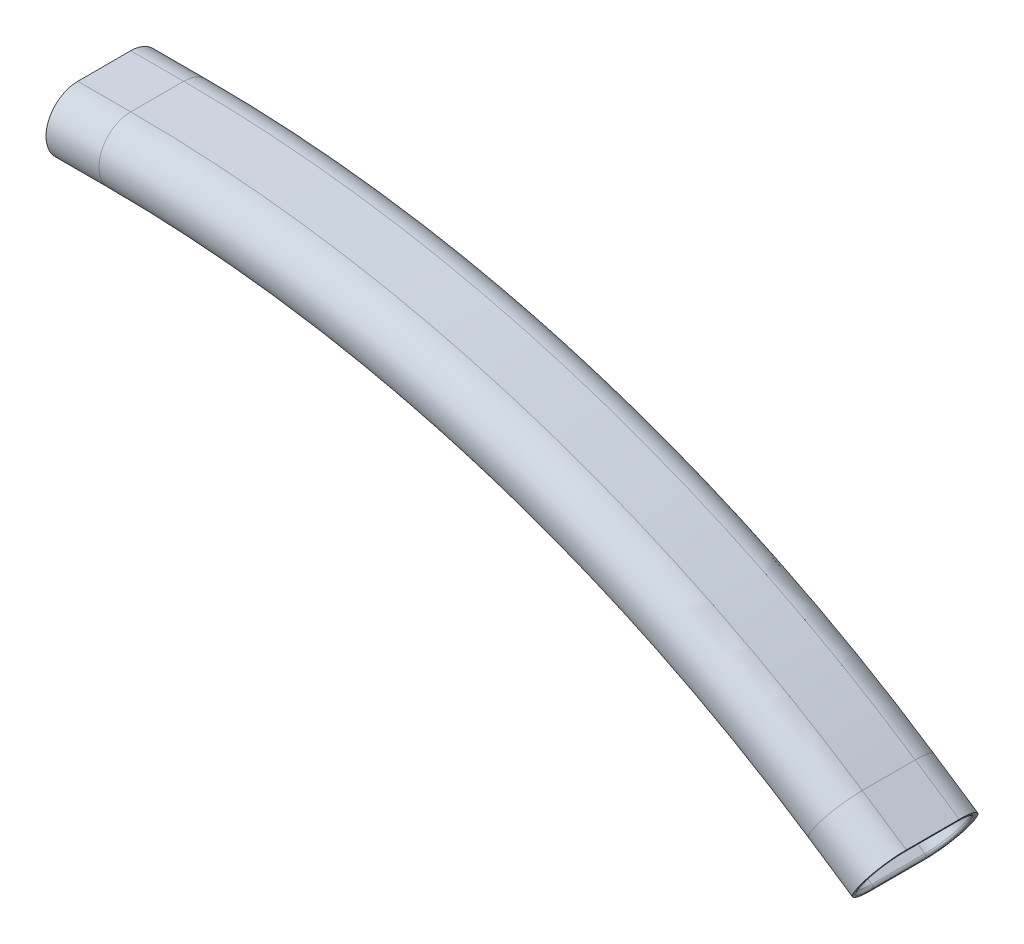
from build123d import *

# Parameters (mm, degrees)
FILLET1_R = 0.5


with BuildPart() as part:
    # Sweep1: sweep along a path in Sketch2path
    with BuildLine(Plane.XY) as sweep1_path:
        Line((0, 100), (10, 100))
        ThreePointArc((10, 100), (80.430596643, 89.552607894), (144.795757594, 59.110153969))
        Line((144.795757594, 59.110153969), (153.110453717, 53.554451639))
    # Sketch3 → Sweep1 (sweep)
    with BuildSketch(Plane(origin=(0, 0, 0), x_dir=(0, 0, -1), z_dir=(1, 0, 0))):
        with BuildLine():
            Line((-5, 106), (5, 106))
            ThreePointArc((5, 106), (11, 100), (5, 94))
            Line((5, 94), (-5, 94))
            ThreePointArc((-5, 94), (-11, 100), (-5, 106))
        make_face()
        with BuildLine():
            Line((-5, 105), (5, 105))
            ThreePointArc((5, 105), (10, 100), (5, 95))
            Line((5, 95), (-5, 95))
            ThreePointArc((-5, 95), (-10, 100), (-5, 105))
        make_face(mode=Mode.SUBTRACT)
    sweep(path=sweep1_path.line)

    # Fillet1
    fillet1_edges = [part.edges().sort_by_distance(p)[0] for p in [
        (0, 100, 10),
        (0, 105, 0),
        (0, 100, -10),
        (153.110453717, 53.554451639, 10),
        (155.888304882, 57.711799701, 0),
        (153.110453717, 53.554451639, -10),
        (0, 95, 0),
        (150.332602552, 49.397103578, 0),
    ]]
    fillet(fillet1_edges, radius=FILLET1_R)


solid = part.part
